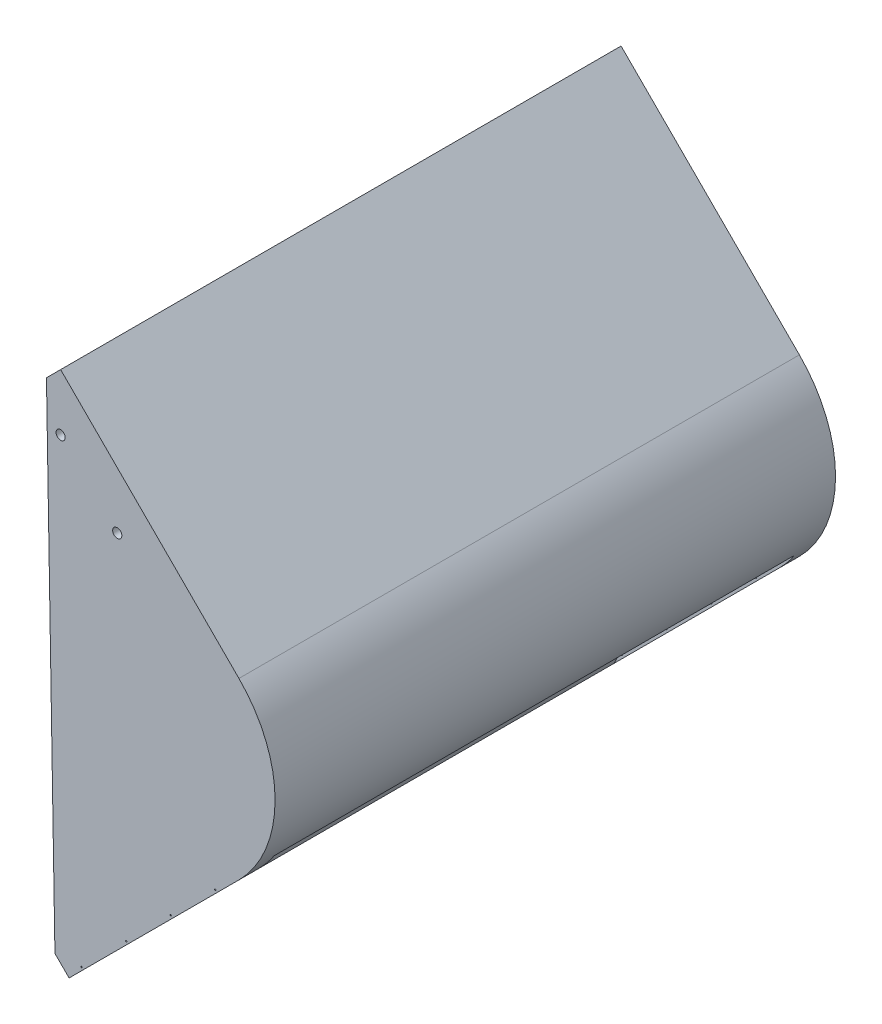
from build123d import *

# Parameters (mm, degrees)
BOSS_EXTRUDE1_DEPTH     = 177.8
BOSS_EXTRUDE2_DEPTH     = 6.35
BOSS_EXTRUDE3_START     = -6.35
BOSS_EXTRUDE3_DEPTH     = 6.35
SKETCH5_W               = 81.82
SKETCH5_H               = 165.1
CUT_EXTRUDE1_DEPTH      = 216.897319711
BOSS_EXTRUDE6_DEPTH     = 165.1
CUT_EXTRUDE2_DEPTH      = 212.237817104
CUT_EXTRUDE2_DEPTH_BACK = 212.237817104
SKETCH9_R               = 1.4605
SKETCH10_R              = 0.2159
CUT_EXTRUDE3_DEPTH      = 212.237817104


with BuildPart() as part:
    # Sketch1 → Boss-Extrude1 (new body)
    with BuildSketch(Plane.XY):
        with BuildLine():
            Line((0, 12.912727148), (-56.568542495, 69.481269642))
            Line((-56.568542495, 69.481269642), (-61.058670555, 64.991141582))
            Line((-61.058670555, 64.991141582), (-4.490128061, 8.422599087))
            ThreePointArc((-4.490128061, 8.422599087), (5.116694028, -14.770321092), (-4.490128061, -37.96324127))
            Line((-4.490128061, -37.96324127), (-58.371664787, -91.844777996))
            Line((-58.371664787, -91.844777996), (-53.881536726, -96.334906057))
            Line((-53.881536726, -96.334906057), (0, -42.453369331))
            ThreePointArc((0, -42.453369331), (11.466694028, -14.770321092), (0, 12.912727148))
        make_face()
    extrude(amount=BOSS_EXTRUDE1_DEPTH)

    # Sketch2 → Boss-Extrude2 (add)
    with BuildSketch(Plane(origin=(0, 0, 0), x_dir=(-1, 0, 0), z_dir=(0, 0, -1))):
        with BuildLine():
            Line((61.058670555, 64.991141582), (58.371664787, -91.844777996))
            Line((58.371664787, -91.844777996), (4.490128061, -37.96324127))
            ThreePointArc((4.490128061, -37.96324127), (-5.116694028, -14.770321092), (4.490128061, 8.422599087))
            Line((4.490128061, 8.422599087), (61.058670555, 64.991141582))
        make_face()
    extrude(amount=-BOSS_EXTRUDE2_DEPTH)

    # Sketch4 → Boss-Extrude3 (add)
    with BuildSketch(Plane.XY.offset(177.8).offset(BOSS_EXTRUDE3_START)):
        with BuildLine():
            Line((-61.058670555, 64.991141582), (-58.371664787, -91.844777996))
            Line((-58.371664787, -91.844777996), (-4.490128061, -37.96324127))
            ThreePointArc((-4.490128061, -37.96324127), (5.116694028, -14.770321092), (-4.490128061, 8.422599087))
            Line((-4.490128061, 8.422599087), (-61.058670555, 64.991141582))
        make_face()
    extrude(amount=BOSS_EXTRUDE3_DEPTH)

    # Sketch5 → Cut-Extrude1 (cut, through all)
    with BuildSketch(Plane(origin=(21.226684665, -21.226684665, 0), x_dir=(0.7071067811865512, 0.7071067811865439, 0), z_dir=(0.7071067811865439, -0.7071067811865512, 0))):
        with Locations((-63.309065338, 88.9)):
            Rectangle(SKETCH5_W, SKETCH5_H)
    extrude(amount=-CUT_EXTRUDE1_DEPTH, mode=Mode.SUBTRACT)

    # Sketch8 → Boss-Extrude6 (add)
    with BuildSketch(Plane.XY.offset(6.35)):
        Polygon((-50.843145831, -78.430564434), (-46.35301777, -82.920692495), (-52.467323164, -94.920692495), (-56.957451225, -90.430564434), align=None)
    extrude(amount=BOSS_EXTRUDE6_DEPTH)

    # Sketch9 → Cut-Extrude2 (cut, two sides: drawn at the far end of the back side and taken through both)
    with BuildSketch(Plane.XY.offset(177.8).offset(-CUT_EXTRUDE2_DEPTH_BACK)):
        with Locations((-56.568542495, 51.5207574)):
            Circle(SKETCH9_R)
        with Locations((-38.608030253, 33.560245158)):
            Circle(SKETCH9_R)
    extrude(amount=CUT_EXTRUDE2_DEPTH + CUT_EXTRUDE2_DEPTH_BACK, mode=Mode.SUBTRACT)

    # Sketch10 → Cut-Extrude3 (cut, through all)
    with BuildSketch(Plane(origin=(0, 0, 0), x_dir=(-1, 0, 0), z_dir=(0, 0, -1))):
        with Locations((49.930224033, -91.305962629)):
            Circle(SKETCH10_R)
        with Locations((35.788088496, -77.163827092)):
            Circle(SKETCH10_R)
        with Locations((21.645952872, -63.021691468)):
            Circle(SKETCH10_R)
        with Locations((7.503817248, -48.879555844)):
            Circle(SKETCH10_R)
        with Locations((-6.638318376, -34.737420221)):
            Circle(SKETCH10_R)
    extrude(amount=-CUT_EXTRUDE3_DEPTH, mode=Mode.SUBTRACT)


solid = part.part
